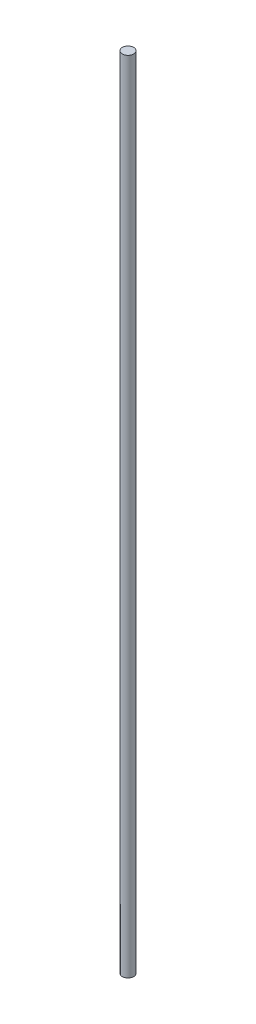
from build123d import *

# Parameters (mm, degrees)
SKETCH1_R           = 4
BOSS_EXTRUDE1_DEPTH = 560


with BuildPart() as part:
    # Sketch1 → Boss-Extrude1 (new body)
    with BuildSketch(Plane(origin=(0, 0, 0), x_dir=(1, 0, 0), z_dir=(0, 1, 0))):
        with Locations(Location((0, 0, 0), (0, 0, 270))):
            Circle(SKETCH1_R)
    extrude(amount=BOSS_EXTRUDE1_DEPTH)


solid = part.part
